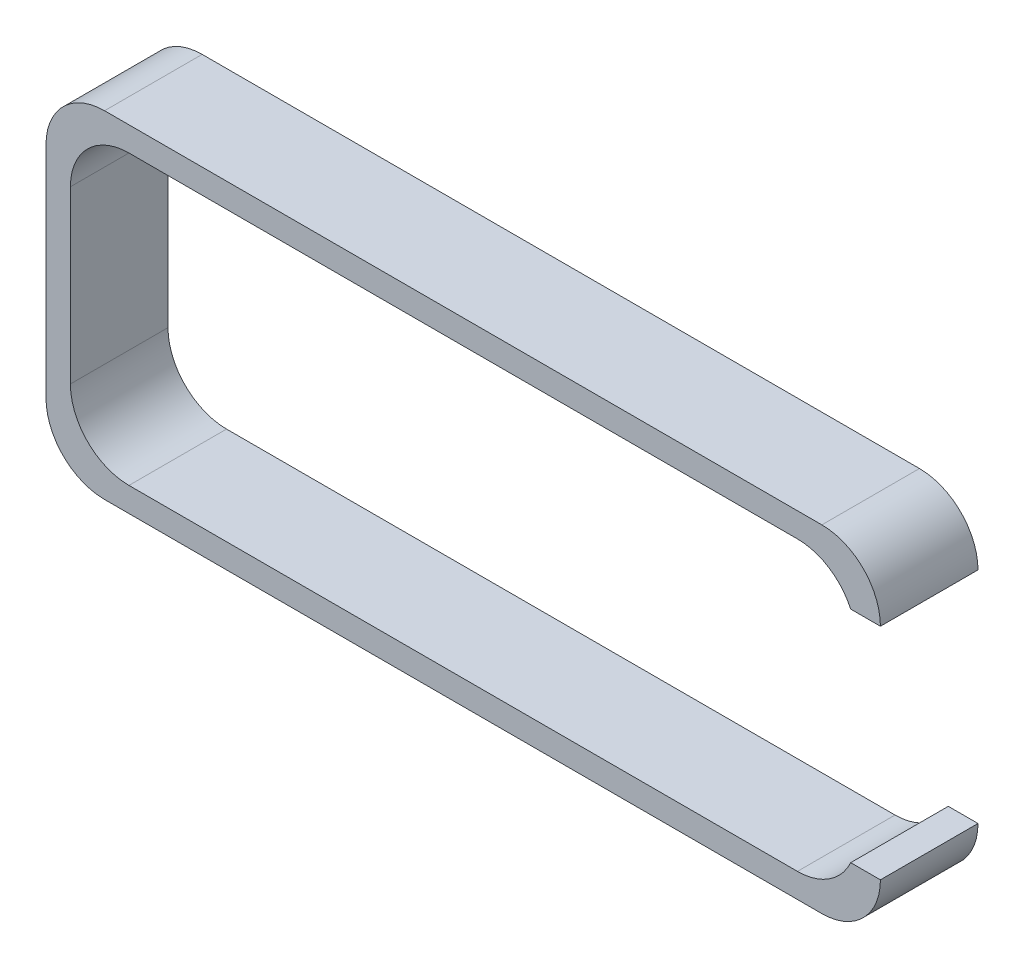
from build123d import *

# Parameters (mm, degrees)
ESQUISSE1_W             = 85.5
ESQUISSE1_H             = 34.5
ESQUISSE1_W_2           = 80.5
ESQUISSE1_H_2           = 29.5
BOSS_EXTRU_1_DEPTH      = 10
CONG_1_R                = 6
CONG_2_R                = 6
ESQUISSE3_W             = 10
ESQUISSE3_H             = 22.5
ENL_V_MAT_EXTRU_1_DEPTH = 10


with BuildPart() as part:
    # Esquisse1 → Boss.-Extru.1 (new body)
    with BuildSketch(Plane.XY):
        with Locations((40.25, 14.75)):
            Rectangle(ESQUISSE1_W, ESQUISSE1_H)
        with Locations((40.25, 14.75)):
            Rectangle(ESQUISSE1_W_2, ESQUISSE1_H_2, mode=Mode.SUBTRACT)
    extrude(amount=BOSS_EXTRU_1_DEPTH)

    # Congé1
    cong_1_edges = [part.edges().sort_by_distance(p)[0] for p in [
        (0, 29.5, 5),
        (0, 0, 5),
        (80.5, 0, 5),
        (80.5, 29.5, 5),
    ]]
    fillet(cong_1_edges, radius=CONG_1_R)

    # Congé2
    cong_2_edges = [part.edges().sort_by_distance(p)[0] for p in [
        (-2.5, 32, 5),
        (83, 32, 5),
        (83, -2.5, 5),
        (-2.5, -2.5, 5),
    ]]
    fillet(cong_2_edges, radius=CONG_2_R)

    # Esquisse3 → Enlèv. mat.-Extru.1 (cut)
    with BuildSketch(Plane(origin=(83, 0, 0), x_dir=(0, 0, -1), z_dir=(1, 0, 0))):
        with Locations((-5, 14.75)):
            Rectangle(ESQUISSE3_W, ESQUISSE3_H)
    extrude(amount=-ENL_V_MAT_EXTRU_1_DEPTH, mode=Mode.SUBTRACT)


solid = part.part
